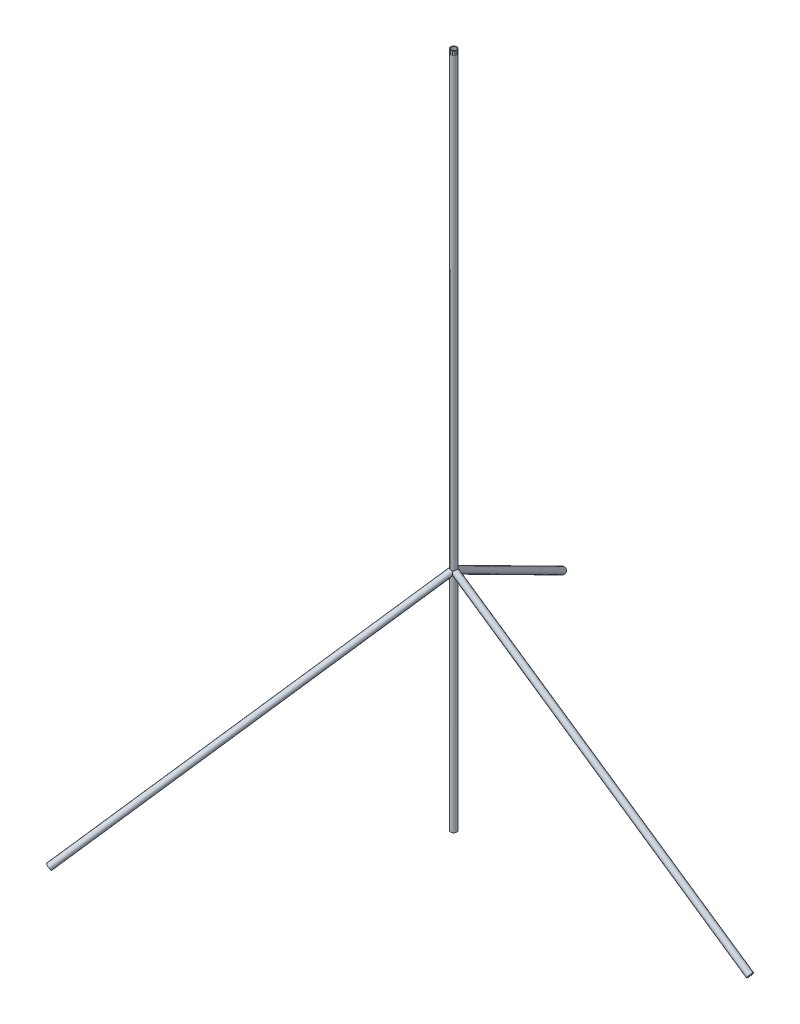
from build123d import *

# Parameters (mm, degrees)
SKETCH1_R           = 21.082
SKETCH1_R_2         = 16.2306
BOSS_EXTRUDE1_DEPTH = 4572
SKETCH2_R           = 21.082
SKETCH2_R_2         = 16.2306
CIRPATTERN1_COUNT   = 3
BOSS_EXTRUDE2_START = -25.4
SKETCH3_R           = 16.2306
BOSS_EXTRUDE2_DEPTH = 25.4
SKETCH4_R           = 16.2306
CUT_EXTRUDE1_DEPTH  = 5293.46562


with BuildPart() as part:
    # Sketch1 → Boss-Extrude1 (new body)
    with BuildSketch(Plane(origin=(0, 0, 0), x_dir=(1, 0, 0), z_dir=(0, 1, 0))):
        with Locations(Location((0, 0, 0), (0, 0, 270))):
            Circle(SKETCH1_R)
        with Locations(Location((0, 0, 0), (0, 0, 270))):
            Circle(SKETCH1_R_2, mode=Mode.SUBTRACT)
    extrude(amount=BOSS_EXTRUDE1_DEPTH)

    # Sweep1: sweep along a curve in space
    with BuildLine() as sweep1_path:
        Line((0, 1524, 0), (2001.115526, 152.4, 0))
    # Sketch2 → Sweep1 (sweep)
    with BuildSketch(Plane(origin=(2001.115526, 152.4, 0), x_dir=(0, 0, -1), z_dir=(0.824842935650694, -0.5653619473462511, 0))):
        Circle(SKETCH2_R)
        Circle(SKETCH2_R_2, mode=Mode.SUBTRACT)
    sweep1 = sweep(path=sweep1_path.line)

    # CirPattern1: Sweep1 ×3 about axis
    cirpattern1_axis = Axis((0, 0, 0), (0, 1, 0))
    for i in range(1, CIRPATTERN1_COUNT):
        add(sweep1.rotate(cirpattern1_axis, i * 360 / CIRPATTERN1_COUNT))

    # Sketch3 → Boss-Extrude2 (add)
    with BuildSketch(Plane(origin=(0, 4572, 0), x_dir=(1, 0, 0), z_dir=(0, 1, 0)).offset(BOSS_EXTRUDE2_START)):
        Polygon((21.825692, 0), (18.901604, 10.912846), (10.912846, 18.901604), (0, 21.825692), (-10.912846, 18.901604), (-18.901604, 10.912846), (-21.825692, 0), (-18.901604, -10.912846), (-10.912846, -18.901604), (0, -21.825692), (10.912846, -18.901604), (18.901604, -10.912846), align=None)
        with Locations(Location((0, 0, 0), (0, 0, 64.623053))):
            Circle(SKETCH3_R, mode=Mode.SUBTRACT)
    extrude(amount=BOSS_EXTRUDE2_DEPTH)

    # Sketch4 → Cut-Extrude1 (cut, through all)
    with BuildSketch(Plane(origin=(0, 4572, 0), x_dir=(1, 0, 0), z_dir=(0, 1, 0))):
        with Locations(Location((0, 0, 0), (0, 0, 270))):
            Circle(SKETCH4_R)
    extrude(amount=-CUT_EXTRUDE1_DEPTH, mode=Mode.SUBTRACT)


solid = part.part
